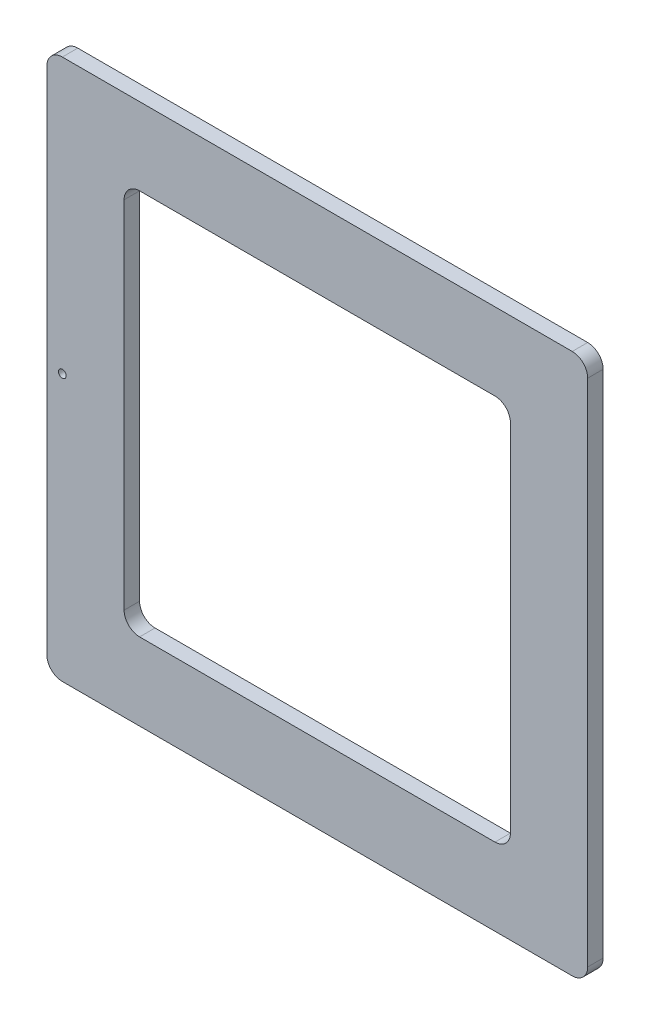
from build123d import *

# Parameters (mm, degrees)
EXTRUDE_1_DEPTH     = 2
SKETCH_2_R          = 0.5
CUT_EXTRUDE_3_DEPTH = 2


with BuildPart() as part:
    # Эскиз1 → Бобышка-Вытянуть1 (new body)
    with BuildSketch(Plane.XY):
        with BuildLine():
            Line((33, -35), (-33, -35))
            ThreePointArc((-33, -35), (-34.414213562, -34.414213562), (-35, -33))
            Line((-35, -33), (-35, 33))
            ThreePointArc((-35, 33), (-34.414213562, 34.414213562), (-33, 35))
            Line((-33, 35), (33, 35))
            ThreePointArc((33, 35), (34.414213562, 34.414213562), (35, 33))
            Line((35, 33), (35, -33))
            ThreePointArc((35, -33), (34.414213562, -34.414213562), (33, -35))
        make_face()
        with BuildLine():
            Line((23, -25), (-23, -25))
            ThreePointArc((-23, -25), (-24.414213562, -24.414213562), (-25, -23))
            Line((-25, -23), (-25, 23))
            ThreePointArc((-25, 23), (-24.414213562, 24.414213562), (-23, 25))
            Line((-23, 25), (23, 25))
            ThreePointArc((23, 25), (24.414213562, 24.414213562), (25, 23))
            Line((25, 23), (25, -23))
            ThreePointArc((25, -23), (24.414213562, -24.414213562), (23, -25))
        make_face(mode=Mode.SUBTRACT)
    extrude(amount=EXTRUDE_1_DEPTH)

    # Эскиз2 → Вырез-Вытянуть3 (cut)
    with BuildSketch(Plane.XY):
        with Locations((-33, -0.5)):
            Circle(SKETCH_2_R)
    extrude(amount=CUT_EXTRUDE_3_DEPTH, mode=Mode.SUBTRACT)


solid = part.part
